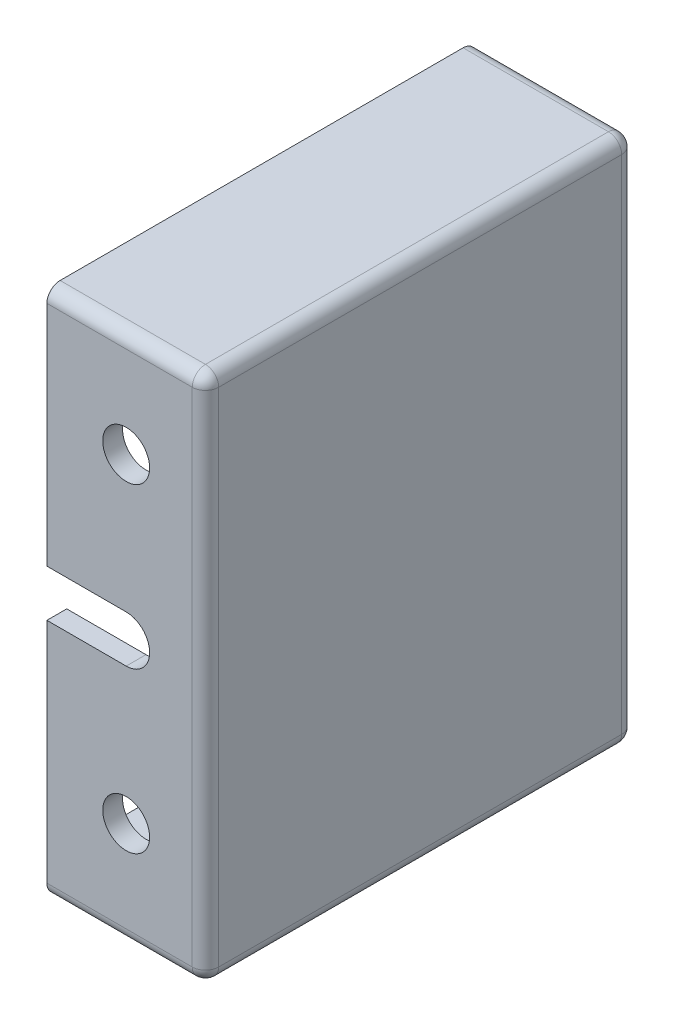
from build123d import *

# Parameters (mm, degrees)
SKETCH1_W                                   = 80
SKETCH1_H                                   = 24
BOSS_EXTRUDE1_DEPTH                         = 65
F_2_MM_TOP_BOT_3_MM_SIDE_T                  = -3
F_2_MM_TOP_BOT_3_MM_SIDE_THICKNESS_2_FACE_W = 59
F_2_MM_TOP_BOT_3_MM_SIDE_THICKNESS_2_FACE_H = 21
F_2_MM_TOP_BOT_3_MM_SIDE_THICKNESS_2_DEPTH  = 2
F_2_MM_TOP_BOT_3_MM_SIDE_THICKNESS_3_FACE_W = 21
F_2_MM_TOP_BOT_3_MM_SIDE_THICKNESS_3_FACE_H = 59
F_2_MM_TOP_BOT_3_MM_SIDE_THICKNESS_3_DEPTH  = 2
F_9_8_MM_PORT_HOLES_DEPTH                   = 3
SKETCH4_R                                   = 3.55
F_7_1_MM_FIXTURE_HOLES_DEPTH                = 10
F_2_MM_RADIUS_R                             = 2
F_8_5_START                                 = -2
SKETCH7_R                                   = 4.25
F_8_5_MM_HOLD_OFFSET_2_MM_DEPTH             = 3.2
R2_FILET_R                                  = 2
SKETCH8_W                                   = 3
SKETCH8_H                                   = 3
F_7_MM_NOTCH_DEPTH                          = 7


with BuildPart() as part:
    # Sketch1 → Boss-Extrude1 (new body)
    with BuildSketch(Plane(origin=(0, 0, 0), x_dir=(0, 1, 0), z_dir=(0, 0, 1))):
        Rectangle(SKETCH1_W, SKETCH1_H)
    extrude(amount=BOSS_EXTRUDE1_DEPTH)

    # 2 mm top/bot 3 mm side
    f_2_mm_top_bot_3_mm_side_openings = [part.faces().sort_by_distance(p)[0] for p in [
        (-12, 0, 32.5),
    ]]
    offset(amount=F_2_MM_TOP_BOT_3_MM_SIDE_T, openings=f_2_mm_top_bot_3_mm_side_openings, kind=Kind.INTERSECTION)

    # 2 mm top/bot 3 mm side thickness 2 face (on inner face of the shell) → 2 mm top/bot 3 mm side thickness 2 (add)
    with BuildSketch(Plane(origin=(-1.5, 37, 32.5), x_dir=(0, 0, 1), z_dir=(0, 1, 0))):
        Rectangle(F_2_MM_TOP_BOT_3_MM_SIDE_THICKNESS_2_FACE_W, F_2_MM_TOP_BOT_3_MM_SIDE_THICKNESS_2_FACE_H)
    extrude(amount=-F_2_MM_TOP_BOT_3_MM_SIDE_THICKNESS_2_DEPTH)

    # 2 mm top/bot 3 mm side thickness 3 face (on inner face of the shell) → 2 mm top/bot 3 mm side thickness 3 (add)
    with BuildSketch(Plane(origin=(-1.5, -37, 32.5), x_dir=(-1, 0, 0), z_dir=(0, -1, 0))):
        Rectangle(F_2_MM_TOP_BOT_3_MM_SIDE_THICKNESS_3_FACE_W, F_2_MM_TOP_BOT_3_MM_SIDE_THICKNESS_3_FACE_H)
    extrude(amount=-F_2_MM_TOP_BOT_3_MM_SIDE_THICKNESS_3_DEPTH)

    # Sketch3 → 9.8 mm port holes (cut)
    with BuildSketch(Plane(origin=(0, 0, 0), x_dir=(1, 0, 0), z_dir=(0, 0, -1))):
        with BuildLine():
            ThreePointArc((4.9, 22.5), (3.464823228, 25.964823228), (0, 27.4))
            Line((0, 27.4), (0, 17.6))
            ThreePointArc((0, 17.6), (3.464823228, 19.035176772), (4.9, 22.5))
        make_face()
        with BuildLine():
            Line((0, 17.6), (0, 27.4))
            ThreePointArc((0, 27.4), (-4.9, 22.5), (0, 17.6))
        make_face()
        with BuildLine():
            ThreePointArc((4.9, 7.5), (3.464823228, 10.964823228), (0, 12.4))
            Line((0, 12.4), (0, 2.6))
            ThreePointArc((0, 2.6), (3.464823228, 4.035176772), (4.9, 7.5))
        make_face()
        with BuildLine():
            Line((0, 2.6), (0, 12.4))
            ThreePointArc((0, 12.4), (-4.9, 7.5), (0, 2.6))
        make_face()
        with BuildLine():
            ThreePointArc((4.9, -7.5), (3.464823228, -4.035176772), (0, -2.6))
            Line((0, -2.6), (0, -12.4))
            ThreePointArc((0, -12.4), (3.464823228, -10.964823228), (4.9, -7.5))
        make_face()
        with BuildLine():
            Line((0, -12.4), (0, -2.6))
            ThreePointArc((0, -2.6), (-4.9, -7.5), (0, -12.4))
        make_face()
        with BuildLine():
            ThreePointArc((4.9, -22.5), (3.464823228, -19.035176772), (0, -17.6))
            Line((0, -17.6), (0, -27.4))
            ThreePointArc((0, -27.4), (3.464823228, -25.964823228), (4.9, -22.5))
        make_face()
        with BuildLine():
            Line((0, -27.4), (0, -17.6))
            ThreePointArc((0, -17.6), (-4.9, -22.5), (0, -27.4))
        make_face()
    extrude(amount=-F_9_8_MM_PORT_HOLES_DEPTH, mode=Mode.SUBTRACT)

    # Sketch4 → 7.1 mm fixture holes (cut)
    with BuildSketch(Plane.XY.offset(65)):
        with Locations((0, 24.2)):
            Circle(SKETCH4_R)
        Circle(SKETCH4_R)
        with Locations((0, -24.2)):
            Circle(SKETCH4_R)
        with BuildLine():
            ThreePointArc((0, -3.55), (-3.55, 0), (0, 3.55))
            Line((0, 3.55), (-12, 3.55))
            Line((-12, 3.55), (-12, -3.55))
            Line((-12, -3.55), (0, -3.55))
        make_face()
    extrude(amount=-F_7_1_MM_FIXTURE_HOLES_DEPTH, mode=Mode.SUBTRACT)

    # 2 mm radius
    f_2_mm_radius_edges = [part.edges().sort_by_distance(p)[0] for p in [
        (9, -35, 32.5),
        (9, 35, 32.5),
        (12, -40, 32.5),
        (12, 40, 32.5),
    ]]
    fillet(f_2_mm_radius_edges, radius=F_2_MM_RADIUS_R)

    # Sketch7 → 8.5 mm hold offset 2 mm (cut)
    with BuildSketch(Plane(origin=(0, 40, 0), x_dir=(-1, 0, 0), z_dir=(0, 1, 0)).offset(F_8_5_START)):
        with Locations(Location((1, 32.5, 0), (0, 0, 90))):
            Circle(SKETCH7_R)
    f_8_5_mm_hold_offset_2_mm = extrude(amount=-F_8_5_MM_HOLD_OFFSET_2_MM_DEPTH, mode=Mode.SUBTRACT)

    # magnet slot mirror: 8.5 mm hold offset 2 mm across plane
    add(f_8_5_mm_hold_offset_2_mm.mirror(Plane.ZX), mode=Mode.SUBTRACT)

    # R2 filet
    r2_filet_edges = [part.edges().sort_by_distance(p)[0] for p in [
        (9, 0, 3),
        (9, 0, 62),
        (-2.5, 35, 3),
        (-2.5, -35, 3),
        (8.414213562, -34.414213562, 3),
        (8.414213562, 34.414213562, 3),
        (-2.5, 35, 62),
        (-2.5, -35, 62),
        (8.414213562, -34.414213562, 62),
        (8.414213562, 34.414213562, 62),
        (12, 0, 0),
        (12, 0, 65),
        (-1, -40, 0),
        (-1, 40, 0),
        (11.414213562, 39.414213562, 0),
        (11.414213562, -39.414213562, 0),
        (-1, -40, 65),
        (-1, 40, 65),
        (11.414213562, 39.414213562, 65),
        (11.414213562, -39.414213562, 65),
    ]]
    fillet(r2_filet_edges, radius=R2_FILET_R)

    # Sketch8 → 7 mm notch (cut)
    with BuildSketch(Plane(origin=(-12, 0, 0), x_dir=(0, -1, 0), z_dir=(-1, 0, 0))):
        with Locations((-35, 32.5)):
            Rectangle(SKETCH8_W, SKETCH8_H)
    f_7_mm_notch = extrude(amount=-F_7_MM_NOTCH_DEPTH, mode=Mode.SUBTRACT)

    # 7 mm notch mirror: 7 mm notch across plane
    add(f_7_mm_notch.mirror(Plane.ZX), mode=Mode.SUBTRACT)


solid = part.part
